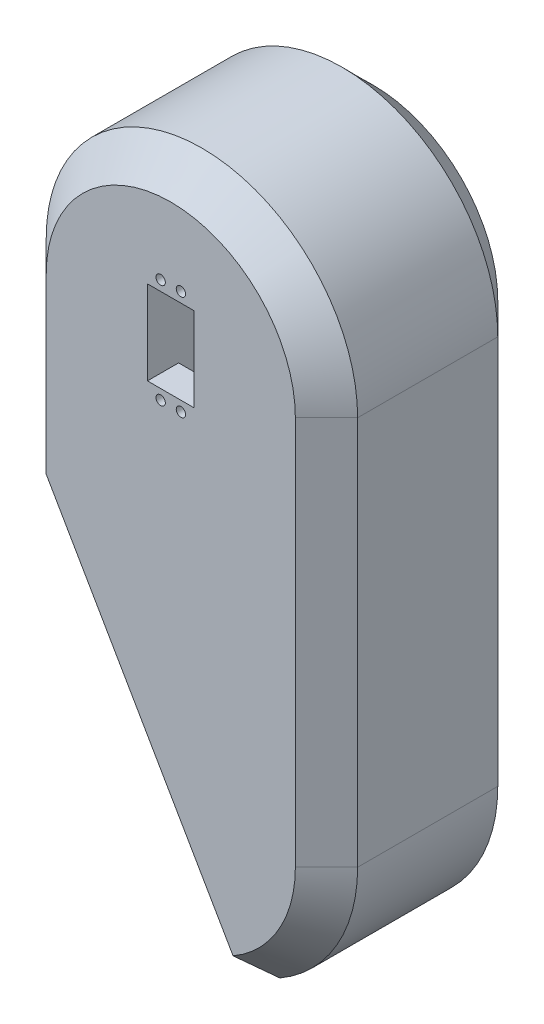
from build123d import *

# Parameters (mm, degrees)
BOSS_EXTRUDE1_DEPTH = 65
CUT_EXTRUDE1_DEPTH  = 194.261480901
SKETCH5_R           = 15
CUT_EXTRUDE4_DEPTH  = 5
SKETCH6_R           = 1.5
CUT_EXTRUDE5_DEPTH  = 7.5
CHAMFER1_SIZE       = 10
SKETCH8_W           = 15
SKETCH8_H           = 40
CUT_EXTRUDE6_DEPTH  = 55
SKETCH9_W           = 15
SKETCH9_H           = 27
SKETCH9_R           = 1.5
CUT_EXTRUDE7_DEPTH  = 191.131533418
FILLET1_R           = 1


with BuildPart() as part:
    # Sketch1 → Boss-Extrude1 (new body)
    with BuildSketch(Plane.XY):
        with BuildLine():
            Line((-50, 125), (-50, 0))
            ThreePointArc((-50, 0), (0, -50), (50, 0))
            Line((50, 0), (50, 125))
            ThreePointArc((50, 125), (0, 175), (-50, 125))
        make_face()
    extrude(amount=BOSS_EXTRUDE1_DEPTH)

    # Sketch2 → Cut-Extrude1 (cut, through all)
    with BuildSketch(Plane.XY.offset(65)):
        Polygon((260.825571734, -451.763142156), (25, -43.301270189), (-50, 86.602540378), (-50, 0), (-50, -471.651143468), (10.233499812, -1413.028395178), (321.059071546, -1393.140393866), align=None)
    extrude(amount=-CUT_EXTRUDE1_DEPTH, mode=Mode.SUBTRACT)

    # Sketch5 → Cut-Extrude4 (cut)
    with BuildSketch(Plane(origin=(0, 0, 0), x_dir=(0, 0, 1), z_dir=(-0.866025403784438, -0.5000000000000012, 0))):
        with Locations(Location((32.5, 25, 0), (0, 0, 270))):
            Circle(SKETCH5_R)
    extrude(amount=-CUT_EXTRUDE4_DEPTH, mode=Mode.SUBTRACT)

    # Sketch6 → Cut-Extrude5 (cut)
    with BuildSketch(Plane(origin=(4.330127019, 2.5, 0), x_dir=(0, 0, 1), z_dir=(-0.8660254037844378, -0.5000000000000012, 0))):
        with Locations(Location((40, 25, 0), (0, 0, 270))):
            Circle(SKETCH6_R)
        with Locations(Location((32.5, 32.5, 0), (0, 0, 270))):
            Circle(SKETCH6_R)
        with Locations(Location((32.5, 17.5, 0), (0, 0, 270))):
            Circle(SKETCH6_R)
        with Locations(Location((25, 25, 0), (0, 0, 270))):
            Circle(SKETCH6_R)
    extrude(amount=-CUT_EXTRUDE5_DEPTH, mode=Mode.SUBTRACT)

    # Chamfer1
    chamfer1_edges = [part.edges().sort_by_distance(p)[0] for p in [
        (43.301270189, -25, 0),
        (43.301270189, -25, 65),
        (50, 62.5, 65),
        (0, 175, 65),
        (50, 62.5, 0),
        (-50, 105.801270189, 0),
        (0, 175, 0),
        (-50, 105.801270189, 65),
    ]]
    chamfer(chamfer1_edges, length=CHAMFER1_SIZE)

    # Sketch8 → Cut-Extrude6 (cut)
    with BuildSketch(Plane(origin=(0, 0, 0), x_dir=(-1, 0, 0), z_dir=(0, 0, -1))):
        with Locations((0, 125)):
            Rectangle(SKETCH8_W, SKETCH8_H)
    extrude(amount=-CUT_EXTRUDE6_DEPTH, mode=Mode.SUBTRACT)

    # Sketch9 → Cut-Extrude7 (cut, through all)
    with BuildSketch(Plane(origin=(0, 0, 55), x_dir=(-1, 0, 0), z_dir=(0, 0, -1))):
        with Locations((0, 125)):
            Rectangle(SKETCH9_W, SKETCH9_H)
        with Locations((-3.25, 108.25)):
            Circle(SKETCH9_R)
        with Locations((3.25, 108.25)):
            Circle(SKETCH9_R)
        with Locations((-3.25, 141.75)):
            Circle(SKETCH9_R)
        with Locations((3.25, 141.75)):
            Circle(SKETCH9_R)
    extrude(amount=-CUT_EXTRUDE7_DEPTH, mode=Mode.SUBTRACT)

    # Fillet1
    fillet1_edges = [part.edges().sort_by_distance(p)[0] for p in [
        (-15.669872981, 37.141016151, 32.5),
        (-20, 34.641016151, 32.5),
    ]]
    fillet(fillet1_edges, radius=FILLET1_R)


solid = part.part
